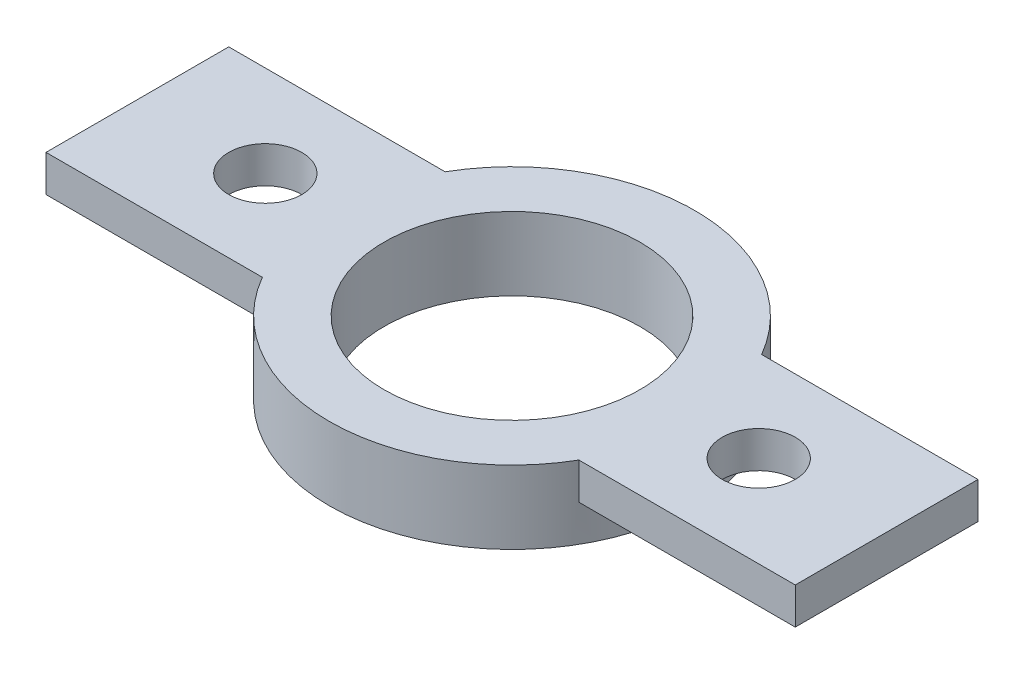
from build123d import *

# Parameters (mm, degrees)
SKETCH1_W           = 35
SKETCH1_H           = 10
BOSS_EXTRUDE1_DEPTH = 2
SKETCH2_R           = 10
BOSS_EXTRUDE2_DEPTH = 4
SKETCH3_R           = 7
CUT_EXTRUDE1_DEPTH  = 2000
SKETCH4_R           = 2
CUT_EXTRUDE2_DEPTH  = 20
SKETCH5_W           = 10
SKETCH5_H           = 2
BOSS_EXTRUDE3_DEPTH = 3
SKETCH6_W           = 10
SKETCH6_H           = 2
BOSS_EXTRUDE4_DEPTH = 3


with BuildPart() as part:
    # Sketch1 → Boss-Extrude1 (new body)
    with BuildSketch(Plane(origin=(0, 0, 0), x_dir=(1, 0, 0), z_dir=(0, 1, 0))):
        with Locations((17.5, 5)):
            Rectangle(SKETCH1_W, SKETCH1_H)
    extrude(amount=BOSS_EXTRUDE1_DEPTH)

    # Sketch2 → Boss-Extrude2 (add)
    with BuildSketch(Plane(origin=(0, 2, 0), x_dir=(1, 0, 0), z_dir=(0, 1, 0))):
        with Locations(Location((17.5, 5, 0), (0, 0, 270))):
            Circle(SKETCH2_R)
    extrude(amount=-BOSS_EXTRUDE2_DEPTH)

    # Sketch3 → Cut-Extrude1 (cut)
    with BuildSketch(Plane(origin=(0, 2, 0), x_dir=(1, 0, 0), z_dir=(0, 1, 0))):
        with Locations(Location((17.5, 5, 0), (0, 0, 270))):
            Circle(SKETCH3_R)
    extrude(amount=-CUT_EXTRUDE1_DEPTH, mode=Mode.SUBTRACT)

    # Sketch4 → Cut-Extrude2 (cut)
    with BuildSketch(Plane.XZ):
        with Locations(Location((4, -5, 0), (0, 0, 270))):
            Circle(SKETCH4_R)
        with Locations(Location((31, -5, 0), (0, 0, 270))):
            Circle(SKETCH4_R)
    extrude(amount=-CUT_EXTRUDE2_DEPTH, mode=Mode.SUBTRACT)

    # Sketch5 → Boss-Extrude3 (add)
    with BuildSketch(Plane.ZY):
        with Locations((-5, 1)):
            Rectangle(SKETCH5_W, SKETCH5_H)
    extrude(amount=BOSS_EXTRUDE3_DEPTH)

    # Sketch6 → Boss-Extrude4 (add)
    with BuildSketch(Plane(origin=(35, 0, 0), x_dir=(0, 0, -1), z_dir=(1, 0, 0))):
        with Locations((5, 1)):
            Rectangle(SKETCH6_W, SKETCH6_H)
    extrude(amount=BOSS_EXTRUDE4_DEPTH)


solid = part.part
